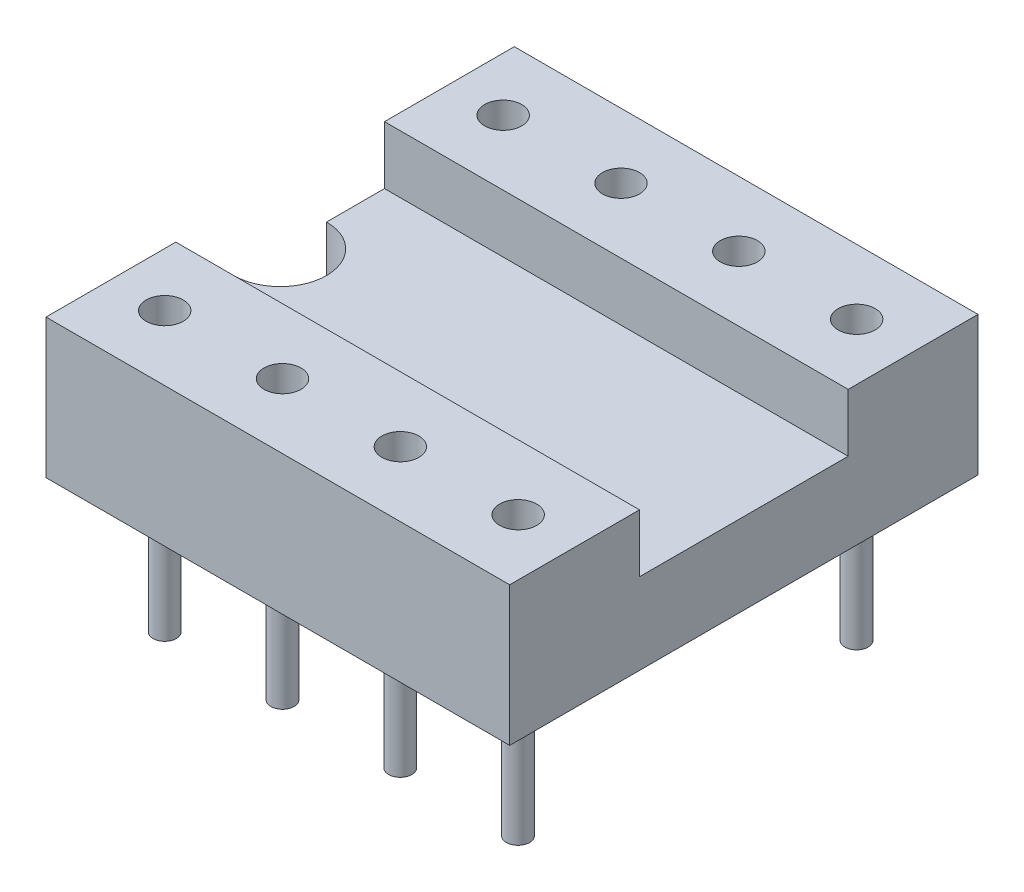
from build123d import *

# Parameters (mm, degrees)
EXTRUSION1_DEPTH        = 10
ENL_V_MAT_EXTRU_1_DEPTH = 12.338650713
ESQUISSE3_R             = 0.4
ENL_V_MAT_EXTRU_2_DEPTH = 2.5
ESQUISSE5_R             = 0.25
EXTRUSION2_DEPTH        = 3


with BuildPart() as part:
    # Esquisse1 → Extrusion1 (new body)
    with BuildSketch(Plane(origin=(0, 0, 0), x_dir=(0, 0, -1), z_dir=(1, 0, 0))):
        Polygon((-2.25, 1.75), (-2.25, 3), (-5.05, 3), (-5.05, 0), (5.05, 0), (5.05, 3), (2.25, 3), (2.25, 1.75), align=None)
    extrude(amount=EXTRUSION1_DEPTH)

    # Esquisse2 → Enlèv. mat.-Extru.1 (cut, through all)
    with BuildSketch(Plane(origin=(0, 1.75, 0), x_dir=(-1, 0, 0), z_dir=(0, 1, 0))):
        with BuildLine():
            Line((0, -1), (0, 1))
            ThreePointArc((0, 1), (-1, 0), (0, -1))
        make_face()
    extrude(amount=-ENL_V_MAT_EXTRU_1_DEPTH, mode=Mode.SUBTRACT)

    # Esquisse3 → Enlèv. mat.-Extru.2 (cut)
    with BuildSketch(Plane(origin=(0, 3, 0), x_dir=(-1, 0, 0), z_dir=(0, 1, 0))):
        with Locations(Location((-1.16, 3.65, 0), (0, 0, 90))):
            Circle(ESQUISSE3_R)
        with Locations(Location((-1.16, -3.65, 0), (0, 0, 270))):
            Circle(ESQUISSE3_R)
        with Locations(Location((-3.701, 3.65, 0), (0, 0, 90))):
            Circle(ESQUISSE3_R)
        with Locations(Location((-3.701, -3.65, 0), (0, 0, 270))):
            Circle(ESQUISSE3_R)
        with Locations(Location((-6.242, 3.65, 0), (0, 0, 90))):
            Circle(ESQUISSE3_R)
        with Locations(Location((-6.242, -3.65, 0), (0, 0, 270))):
            Circle(ESQUISSE3_R)
        with Locations(Location((-8.783, 3.65, 0), (0, 0, 90))):
            Circle(ESQUISSE3_R)
        with Locations(Location((-8.783, -3.65, 0), (0, 0, 270))):
            Circle(ESQUISSE3_R)
    extrude(amount=-ENL_V_MAT_EXTRU_2_DEPTH, mode=Mode.SUBTRACT)

    # Esquisse5 → Extrusion2 (add)
    with BuildSketch(Plane.XZ):
        with Locations(Location((1.16, 3.65, 0), (0, 0, 90))):
            Circle(ESQUISSE5_R)
        with Locations(Location((1.16, -3.65, 0), (0, 0, 90))):
            Circle(ESQUISSE5_R)
        with Locations(Location((3.7, -3.65, 0), (0, 0, 90))):
            Circle(ESQUISSE5_R)
        with Locations(Location((3.7, 3.65, 0), (0, 0, 90))):
            Circle(ESQUISSE5_R)
        with Locations(Location((6.24, -3.65, 0), (0, 0, 90))):
            Circle(ESQUISSE5_R)
        with Locations(Location((6.24, 3.65, 0), (0, 0, 90))):
            Circle(ESQUISSE5_R)
        with Locations(Location((8.78, -3.65, 0), (0, 0, 90))):
            Circle(ESQUISSE5_R)
        with Locations(Location((8.78, 3.65, 0), (0, 0, 90))):
            Circle(ESQUISSE5_R)
    extrude(amount=EXTRUSION2_DEPTH)


solid = part.part
